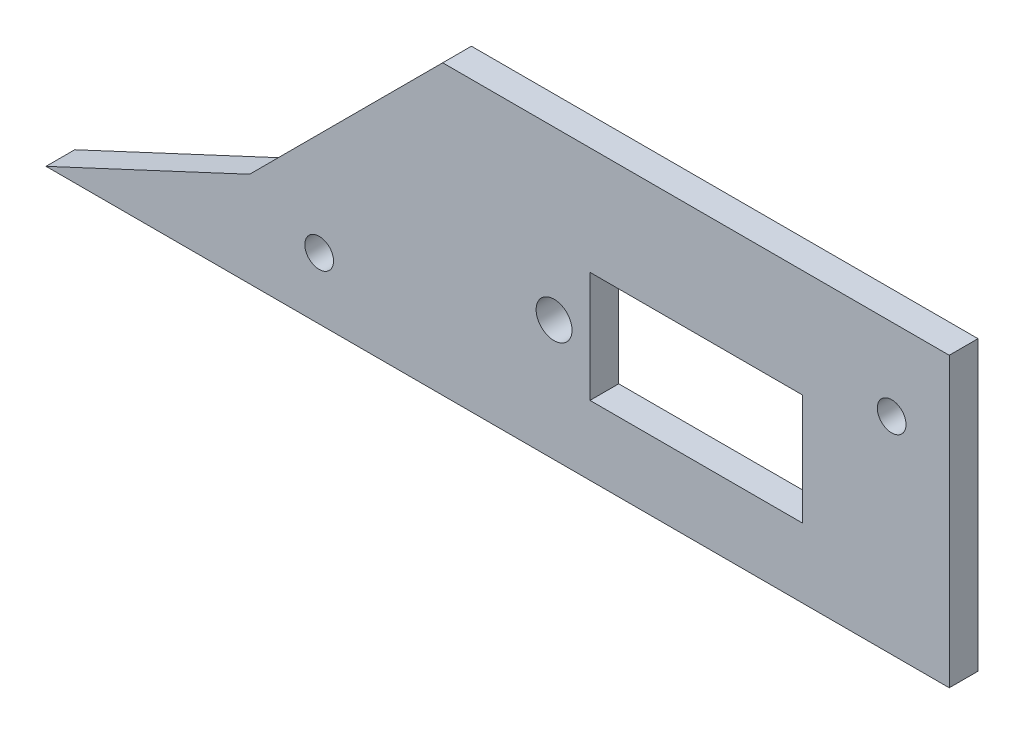
from build123d import *

# Parameters (mm, degrees)
SKETCH_1_R      = 1.25
SKETCH_1_R_2    = 1
EXTRUDE_1_DEPTH = 2


with BuildPart() as part:
    # Эскиз1 → Бобышка-Вытянуть1 (new body)
    with BuildSketch(Plane.XY):
        Polygon((15, -49), (15, -28.957842446), (-20.251430991, -28.957842446), (-33.686459833, -42.392871289), (-47.855493079, -49), align=None)
        with Locations((-12.5, -40.578921223)):
            Circle(SKETCH_1_R, mode=Mode.SUBTRACT)
        with Locations((-28.845458385, -44.710050328)):
            Circle(SKETCH_1_R_2, mode=Mode.SUBTRACT)
        with Locations((10.992087761, -34.64156265)):
            Circle(SKETCH_1_R_2, mode=Mode.SUBTRACT)
        Polygon((-10, -36.459984998), (4.798276813, -36.459984998), (4.798276813, -43.678921223), (4.798276813, -44.178921223), (-10, -44.178921223), (-10, -43.678921223), align=None, mode=Mode.SUBTRACT)
    extrude(amount=EXTRUDE_1_DEPTH)


solid = part.part
